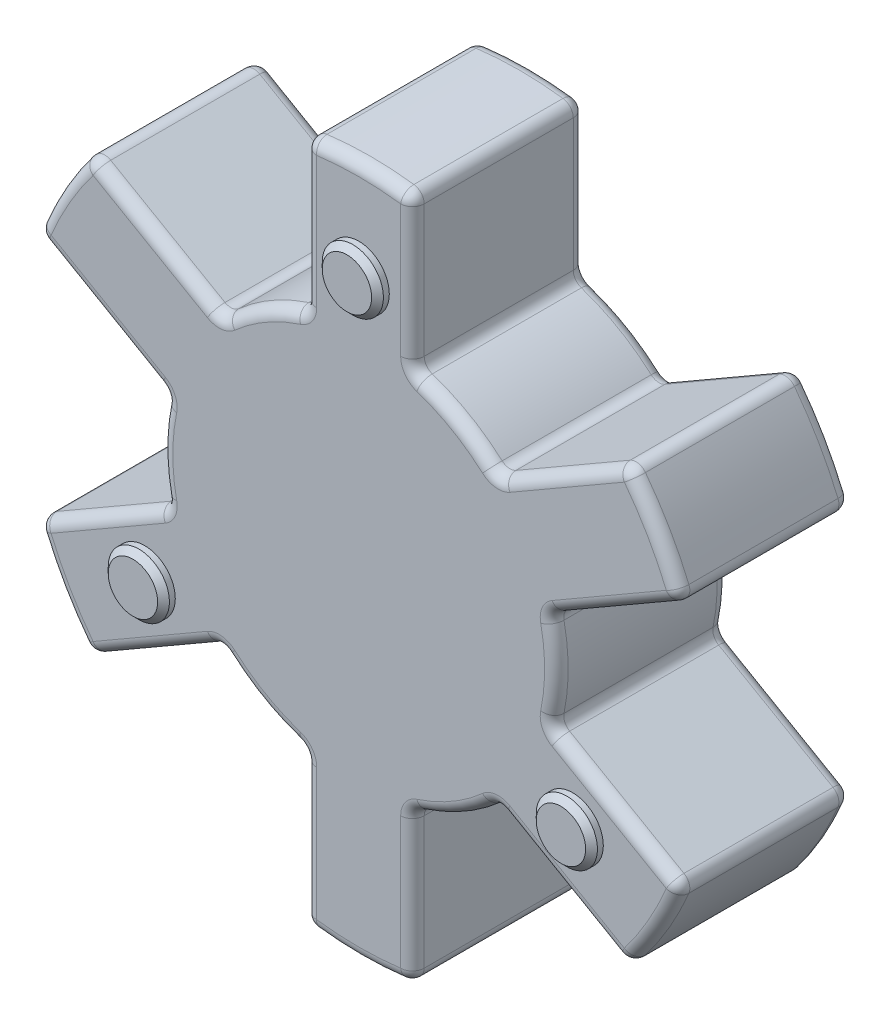
from build123d import *

# Parameters (mm, degrees)
SKETCH1_W          = 22.3647
SKETCH1_H          = 11.176
CUT_EXTRUDE1_DEPTH = 34.544933868
CUT_EXTRUDE2_DEPTH = 34.544933868
CUT_EXTRUDE3_DEPTH = 34.544933868
CUT_EXTRUDE4_DEPTH = 34.544933868
CUT_EXTRUDE5_DEPTH = 34.544933868
CUT_EXTRUDE6_DEPTH = 33.569010661
FILLET1_R          = 0.762


with BuildPart() as part:
    # Sketch1 → Revolve1 (revolve)
    with BuildSketch(Plane(origin=(0, 0, 0), x_dir=(1, 0, 0), z_dir=(0, 1, 0))):
        with Locations((11.18235, 5.588)):
            Rectangle(SKETCH1_W, SKETCH1_H)
    revolve(axis=Axis((0, 0, -11.176), (0, 0, 1)))

    # Sketch2 → Cut-Extrude1 (cut, through all)
    with BuildSketch(Plane(origin=(0, 0, -11.176), x_dir=(-1, 0, 0), z_dir=(0, 0, -1))):
        with BuildLine():
            Line((3.4798, 22.092324415), (3.4798, 12.319576069))
            ThreePointArc((3.4798, 12.319576069), (6.4008, 11.086510809), (8.92916584, 9.173383235))
            Line((8.92916584, 9.173383235), (17.392614172, 14.059757408))
            ThreePointArc((17.392614172, 14.059757408), (11.18235, 19.368398348), (3.4798, 22.092324415))
        make_face()
    extrude(amount=-CUT_EXTRUDE1_DEPTH, mode=Mode.SUBTRACT)

    # Sketch3 → Cut-Extrude2 (cut, through all)
    with BuildSketch(Plane(origin=(0, 0, -11.176), x_dir=(-1, 0, 0), z_dir=(0, 0, -1))):
        with BuildLine():
            Line((20.872414172, 8.032567007), (12.40896584, 3.146192834))
            ThreePointArc((12.40896584, 3.146192834), (12.8016, 0), (12.40896584, -3.146192834))
            Line((12.40896584, -3.146192834), (20.872414172, -8.032567007))
            ThreePointArc((20.872414172, -8.032567007), (22.3647, 0), (20.872414172, 8.032567007))
        make_face()
    extrude(amount=-CUT_EXTRUDE2_DEPTH, mode=Mode.SUBTRACT)

    # Sketch4 → Cut-Extrude3 (cut, through all)
    with BuildSketch(Plane(origin=(0, 0, -11.176), x_dir=(-1, 0, 0), z_dir=(0, 0, -1))):
        with BuildLine():
            Line((17.392614172, -14.059757408), (8.92916584, -9.173383235))
            ThreePointArc((8.92916584, -9.173383235), (6.4008, -11.086510809), (3.4798, -12.319576069))
            Line((3.4798, -12.319576069), (3.4798, -22.092324415))
            ThreePointArc((3.4798, -22.092324415), (11.18235, -19.368398348), (17.392614172, -14.059757408))
        make_face()
    extrude(amount=-CUT_EXTRUDE3_DEPTH, mode=Mode.SUBTRACT)

    # Sketch5 → Cut-Extrude4 (cut, through all)
    with BuildSketch(Plane(origin=(0, 0, -11.176), x_dir=(-1, 0, 0), z_dir=(0, 0, -1))):
        with BuildLine():
            Line((-3.4798, -22.092324415), (-3.4798, -12.319576069))
            ThreePointArc((-3.4798, -12.319576069), (-6.4008, -11.086510809), (-8.92916584, -9.173383235))
            Line((-8.92916584, -9.173383235), (-17.392614172, -14.059757408))
            ThreePointArc((-17.392614172, -14.059757408), (-11.18235, -19.368398348), (-3.4798, -22.092324415))
        make_face()
    extrude(amount=-CUT_EXTRUDE4_DEPTH, mode=Mode.SUBTRACT)

    # Sketch6 → Cut-Extrude5 (cut, through all)
    with BuildSketch(Plane(origin=(0, 0, -11.176), x_dir=(-1, 0, 0), z_dir=(0, 0, -1))):
        with BuildLine():
            Line((-20.872414172, -8.032567007), (-12.40896584, -3.146192834))
            ThreePointArc((-12.40896584, -3.146192834), (-12.8016, 0), (-12.40896584, 3.146192834))
            Line((-12.40896584, 3.146192834), (-20.872414172, 8.032567007))
            ThreePointArc((-20.872414172, 8.032567007), (-22.3647, 0), (-20.872414172, -8.032567007))
        make_face()
    extrude(amount=-CUT_EXTRUDE5_DEPTH, mode=Mode.SUBTRACT)

    # Sketch7 → Cut-Extrude6 (cut, through all)
    with BuildSketch(Plane(origin=(0, 0, -11.176), x_dir=(-1, 0, 0), z_dir=(0, 0, -1))):
        with BuildLine():
            Line((-17.392614172, 14.059757408), (-8.92916584, 9.173383235))
            ThreePointArc((-8.92916584, 9.173383235), (-6.4008, 11.086510809), (-3.4798, 12.319576069))
            Line((-3.4798, 12.319576069), (-3.4798, 22.092324415))
            ThreePointArc((-3.4798, 22.092324415), (-11.18235, 19.368398348), (-17.392614172, 14.059757408))
        make_face()
    extrude(amount=-CUT_EXTRUDE6_DEPTH, mode=Mode.SUBTRACT)

    # Sketch8 → Revolve2 (revolve)
    with BuildSketch(Plane.XZ.offset(8.001), mode=Mode.PRIVATE) as revolve2_sk:
        Polygon((15.839338511, -11.176), (13.858138511, -11.176), (13.858138511, -11.938), (15.458300264, -11.938), (15.839338511, -11.556952644), align=None)
    revolve(revolve2_sk.sketch.rotate(Axis((13.858138511, -8.001, -11.176), (0, 0, -1)), 180), axis=Axis((13.858138511, -8.001, -11.176), (0, 0, -1)))

    # Sketch9 → Revolve3 (revolve)
    with BuildSketch(Plane.XZ.offset(8.001), mode=Mode.PRIVATE) as revolve3_sk:
        Polygon((-11.876938511, -11.176), (-13.858138511, -11.176), (-13.858138511, -11.938), (-12.257976759, -11.938), (-11.876938511, -11.556952644), align=None)
    revolve(revolve3_sk.sketch.rotate(Axis((-13.858138511, -8.001, -11.176), (0, 0, -1)), 180), axis=Axis((-13.858138511, -8.001, -11.176), (0, 0, -1)))

    # Sketch10 → Revolve4 (revolve)
    with BuildSketch(Plane.XZ.offset(-16.002), mode=Mode.PRIVATE) as revolve4_sk:
        Polygon((1.9812, -11.176), (0, -11.176), (0, -11.938), (1.600161752, -11.938), (1.9812, -11.556952644), align=None)
    revolve(revolve4_sk.sketch.rotate(Axis((0, 16.002, -11.176), (0, 0, -1)), 180), axis=Axis((0, 16.002, -11.176), (0, 0, -1)))

    # Sketch11 → Revolve5 (revolve)
    with BuildSketch(Plane(origin=(0, -8.001, 0), x_dir=(1, 0, 0), z_dir=(0, 1, 0))):
        Polygon((15.839338511, 0), (13.858138511, 0), (13.858138511, -0.762), (15.458300264, -0.762), (15.839338511, -0.380952645), align=None)
    revolve(axis=Axis((13.858138511, -8.001, 0), (0, 0, 1)))

    # Sketch12 → Revolve6 (revolve)
    with BuildSketch(Plane(origin=(0, -8.001, 0), x_dir=(1, 0, 0), z_dir=(0, 1, 0))):
        Polygon((-11.876938511, 0), (-13.858138511, 0), (-13.858138511, -0.762), (-12.257976759, -0.762), (-11.876938511, -0.380952645), align=None)
    revolve(axis=Axis((-13.858138511, -8.001, 0), (0, 0, 1)))

    # Sketch13 → Revolve7 (revolve)
    with BuildSketch(Plane(origin=(0, 16.002, 0), x_dir=(1, 0, 0), z_dir=(0, 1, 0))):
        Polygon((1.9812, 0), (0, 0), (0, -0.762), (1.600161752, -0.762), (1.9812, -0.380952645), align=None)
    revolve(axis=Axis((0, 16.002, 0), (0, 0, 1)))

    # Fillet1
    fillet1_edges = [part.edges().sort_by_distance(p)[0] for p in [
        (-19.368398348, 11.18235, -11.176),
        (-3.4798, 22.092324415, -5.588),
        (-13.160890006, 11.616570321, 0),
        (-17.392614172, 14.059757408, -5.588),
        (-6.4008, 11.086510809, 0),
        (-8.92916584, 9.173383235, -5.588),
        (-3.4798, 17.205950242, 0),
        (-3.4798, 12.319576069, -5.588),
        (-3.4798, 17.205950242, -11.176),
        (-6.4008, 11.086510809, -11.176),
        (-13.160890006, 11.616570321, -11.176),
        (-19.368398348, -11.18235, 0),
        (-19.368398348, -11.18235, -11.176),
        (-20.872414172, 8.032567007, -5.588),
        (-16.640690006, -5.589379921, 0),
        (-20.872414172, -8.032567007, -5.588),
        (-12.8016, 0, 0),
        (-12.40896584, -3.146192834, -5.588),
        (-16.640690006, 5.589379921, 0),
        (-12.40896584, 3.146192834, -5.588),
        (-16.640690006, 5.589379921, -11.176),
        (-12.8016, 0, -11.176),
        (-16.640690006, -5.589379921, -11.176),
        (0, -22.3647, 0),
        (0, -22.3647, -11.176),
        (-17.392614172, -14.059757408, -5.588),
        (-3.4798, -17.205950242, 0),
        (-3.4798, -22.092324415, -5.588),
        (-6.4008, -11.086510809, 0),
        (-3.4798, -12.319576069, -5.588),
        (-13.160890006, -11.616570321, 0),
        (-8.92916584, -9.173383235, -5.588),
        (-13.160890006, -11.616570321, -11.176),
        (-6.4008, -11.086510809, -11.176),
        (-3.4798, -17.205950242, -11.176),
        (19.368398348, -11.18235, 0),
        (19.368398348, -11.18235, -11.176),
        (3.4798, -22.092324415, -5.588),
        (13.160890006, -11.616570321, 0),
        (17.392614172, -14.059757408, -5.588),
        (6.4008, -11.086510809, 0),
        (8.92916584, -9.173383235, -5.588),
        (3.4798, -17.205950242, 0),
        (3.4798, -12.319576069, -5.588),
        (3.4798, -17.205950242, -11.176),
        (6.4008, -11.086510809, -11.176),
        (13.160890006, -11.616570321, -11.176),
        (19.368398348, 11.18235, 0),
        (19.368398348, 11.18235, -11.176),
        (20.872414172, -8.032567007, -5.588),
        (16.640690006, 5.589379921, 0),
        (20.872414172, 8.032567007, -5.588),
        (12.8016, 0, 0),
        (12.40896584, 3.146192834, -5.588),
        (16.640690006, -5.589379921, 0),
        (12.40896584, -3.146192834, -5.588),
        (16.640690006, -5.589379921, -11.176),
        (12.8016, 0, -11.176),
        (16.640690006, 5.589379921, -11.176),
        (0, 22.3647, 0),
        (-19.368398348, 11.18235, 0),
        (0, 22.3647, -11.176),
        (17.392614172, 14.059757408, -5.588),
        (3.4798, 17.205950242, 0),
        (3.4798, 22.092324415, -5.588),
        (6.4008, 11.086510809, 0),
        (3.4798, 12.319576069, -5.588),
        (13.160890006, 11.616570321, 0),
        (8.92916584, 9.173383235, -5.588),
        (13.160890006, 11.616570321, -11.176),
        (6.4008, 11.086510809, -11.176),
        (3.4798, 17.205950242, -11.176),
    ]]
    fillet(fillet1_edges, radius=FILLET1_R)


solid = part.part
